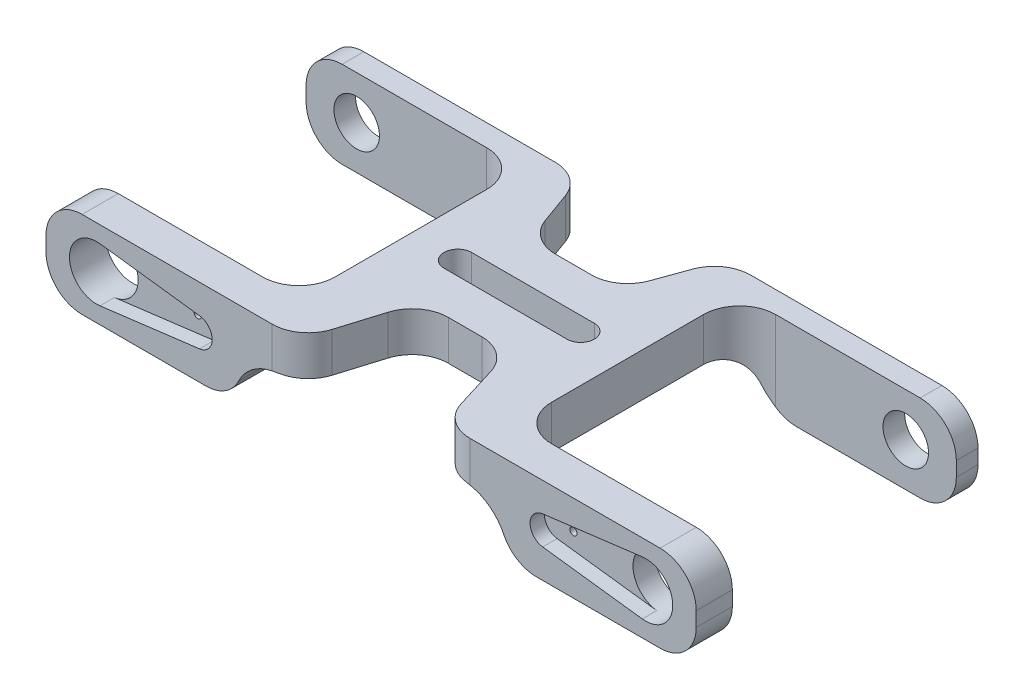
from build123d import *

# Parameters (mm, degrees)
Y_KSEKLIK_EKSTR_ZYON1_DEPTH = 12
IZIM3_R                     = 3.15
KES_EKSTR_ZYON1_DEPTH       = 61.745370194
KES_EKSTR_ZYON2_DEPTH       = 2
KES_EKSTR_ZYON5_REACH       = 62.745
IZIM8_R                     = 3.75
KES_EKSTR_ZYON3_REACH       = 61.481
IZIM6_R                     = 0.5
KES_EKSTR_ZYON4_DEPTH       = 21
RADYUS1_R                   = 5
FILLET1_R                   = 5
CUT_EXTRUDE2_DEPTH          = 10


with BuildPart() as part:
    # Çizim2 → Yükseklik-Ekstrüzyon1 (new body)
    with BuildSketch(Plane(origin=(0, 0, 0), x_dir=(1, 0, 0), z_dir=(0, 1, 0))):
        with BuildLine():
            Line((-45, -15.5), (-45, -20.5))
            Line((-45, -20.5), (-10, -20.5))
            Line((-10, -20.5), (-6.022579038, -7.5))
            Line((-6.022579038, -7.5), (0, -7.5))
            Line((0, -7.5), (0, 7.5))
            Line((0, 7.5), (-6.022579038, 7.5))
            Line((-6.022579038, 7.5), (-10, 18.5))
            Line((-10, 18.5), (-45, 18.5))
            Line((-45, 18.5), (-45, 15.5))
            Line((-45, 15.5), (-20, 15.5))
            ThreePointArc((-20, 15.5), (-16.464466094, 14.035533906), (-15, 10.5))
            Line((-15, 10.5), (-15, -10.5))
            ThreePointArc((-15, -10.5), (-16.464466094, -14.035533906), (-20, -15.5))
            Line((-20, -15.5), (-45, -15.5))
        make_face()
    y_kseklik_ekstr_zyon1 = extrude(amount=Y_KSEKLIK_EKSTR_ZYON1_DEPTH)

    # Çizim3 → Kes-Ekstrüzyon1 (cut, through all)
    with BuildSketch(Plane.XY.offset(20.5)):
        with Locations((-38, 6)):
            Circle(IZIM3_R)
    kes_ekstr_zyon1 = extrude(amount=-KES_EKSTR_ZYON1_DEPTH, mode=Mode.SUBTRACT)

    # Çizim5 → Kes-Ekstrüzyon2 (cut)
    with BuildSketch(Plane.XY.offset(20.5)):
        with BuildLine():
            ThreePointArc((-34.25, 6), (-35.1875, 3.519608146), (-37.53125, 2.279412219))
            Line((-37.53125, 2.279412219), (-23.75, 4.015686517))
            ThreePointArc((-23.75, 4.015686517), (-22, 6), (-23.75, 7.984313483))
            Line((-23.75, 7.984313483), (-37.53125, 9.720587781))
            ThreePointArc((-37.53125, 9.720587781), (-35.1875, 8.480391854), (-34.25, 6))
        make_face()
    kes_ekstr_zyon2 = extrude(amount=-KES_EKSTR_ZYON2_DEPTH, mode=Mode.SUBTRACT)

    # Çizim8 → Kes-Ekstrüzyon5 (cut, up to next)
    with BuildSketch(Plane.XY.offset(20.5), mode=Mode.PRIVATE) as kes_ekstr_zyon5_sk1:
        with Locations((-38, 6)):
            Circle(IZIM8_R)
    kes_ekstr_zyon5_tool1 = extrude(kes_ekstr_zyon5_sk1.sketch, amount=-KES_EKSTR_ZYON5_REACH, mode=Mode.PRIVATE) & part.part
    kes_ekstr_zyon5 = kes_ekstr_zyon5_tool1.solids().sort_by_distance((-38, 6, 20.5))[0]
    add(kes_ekstr_zyon5, mode=Mode.SUBTRACT)

    # Çizim6 → Kes-Ekstrüzyon3 (cut, up to next)
    with BuildSketch(Plane.XY.offset(18.5), mode=Mode.PRIVATE) as kes_ekstr_zyon3_sk1:
        with Locations((-26, 6)):
            Circle(IZIM6_R)
    kes_ekstr_zyon3_tool1 = extrude(kes_ekstr_zyon3_sk1.sketch, amount=-KES_EKSTR_ZYON3_REACH, mode=Mode.PRIVATE) & part.part
    kes_ekstr_zyon3 = kes_ekstr_zyon3_tool1.solids().sort_by_distance((-26, 6, 18.5))[0]
    add(kes_ekstr_zyon3, mode=Mode.SUBTRACT)

    # Aynalama1: Yükseklik-Ekstrüzyon1, Kes-Ekstrüzyon1, Kes-Ekstrüzyon2, Kes-Ekstrüzyon5, Kes-Ekstrüzyon3 across plane
    add(y_kseklik_ekstr_zyon1.mirror(Plane(origin=(0, 12, -7.5), x_dir=(0, 0, 1), z_dir=(-1, 0, 0))))
    add(kes_ekstr_zyon1.mirror(Plane(origin=(0, 12, -7.5), x_dir=(0, 0, 1), z_dir=(-1, 0, 0))), mode=Mode.SUBTRACT)
    add(kes_ekstr_zyon2.mirror(Plane(origin=(0, 12, -7.5), x_dir=(0, 0, 1), z_dir=(-1, 0, 0))), mode=Mode.SUBTRACT)
    add(kes_ekstr_zyon5.mirror(Plane(origin=(0, 12, -7.5), x_dir=(0, 0, 1), z_dir=(-1, 0, 0))), mode=Mode.SUBTRACT)
    add(kes_ekstr_zyon3.mirror(Plane(origin=(0, 12, -7.5), x_dir=(0, 0, 1), z_dir=(-1, 0, 0))), mode=Mode.SUBTRACT)

    # Çizim7 → Kes-Ekstrüzyon4 (cut, symmetric)
    with BuildSketch(Plane.XY):
        with BuildLine():
            Line((-12.5, 6.5), (12.5, 6.5))
            ThreePointArc((12.5, 6.5), (19, 0), (12.5, -6.5))
            Line((12.5, -6.5), (-12.5, -6.5))
            ThreePointArc((-12.5, -6.5), (-19, 0), (-12.5, 6.5))
        make_face()
    extrude(amount=KES_EKSTR_ZYON4_DEPTH, both=True, mode=Mode.SUBTRACT)

    # Radyus1
    radyus1_edges = [part.edges().sort_by_distance(p)[0] for p in [
        (-45, 0, -17),
        (-19, 0, 17.949489743),
        (-19, 0, -16.949489743),
        (19, 0, 17.949489743),
        (19, 0, -16.949489743),
        (-45, 0, 18),
        (-45, 12, -17),
        (-45, 12, 18),
        (45, 12, -17),
        (45, 12, 18),
        (45, 0, 18),
        (45, 0, -17),
    ]]
    fillet(radyus1_edges, radius=RADYUS1_R)

    # Fillet1
    fillet1_edges = [part.edges().sort_by_distance(p)[0] for p in [
        (10, 9.25, 20.5),
        (6.022579038, 9.25, 7.5),
        (-10, 9.25, 20.5),
        (-6.022579038, 9.25, 7.5),
        (10, 9.25, -18.5),
        (6.022579038, 9.25, -7.5),
        (-10, 9.25, -18.5),
        (-6.022579038, 9.25, -7.5),
    ]]
    fillet(fillet1_edges, radius=FILLET1_R)

    # Sketch2 → Cut-Extrude2 (cut)
    with BuildSketch(Plane(origin=(0, 12, 0), x_dir=(1, 0, 0), z_dir=(0, 1, 0))):
        with BuildLine():
            Line((8.5, -1.9), (-8.5, -1.9))
            ThreePointArc((-8.5, -1.9), (-10.4, 0), (-8.5, 1.9))
            Line((-8.5, 1.9), (8.5, 1.9))
            ThreePointArc((8.5, 1.9), (10.4, 0), (8.5, -1.9))
        make_face()
    extrude(amount=-CUT_EXTRUDE2_DEPTH, mode=Mode.SUBTRACT)


solid = part.part
